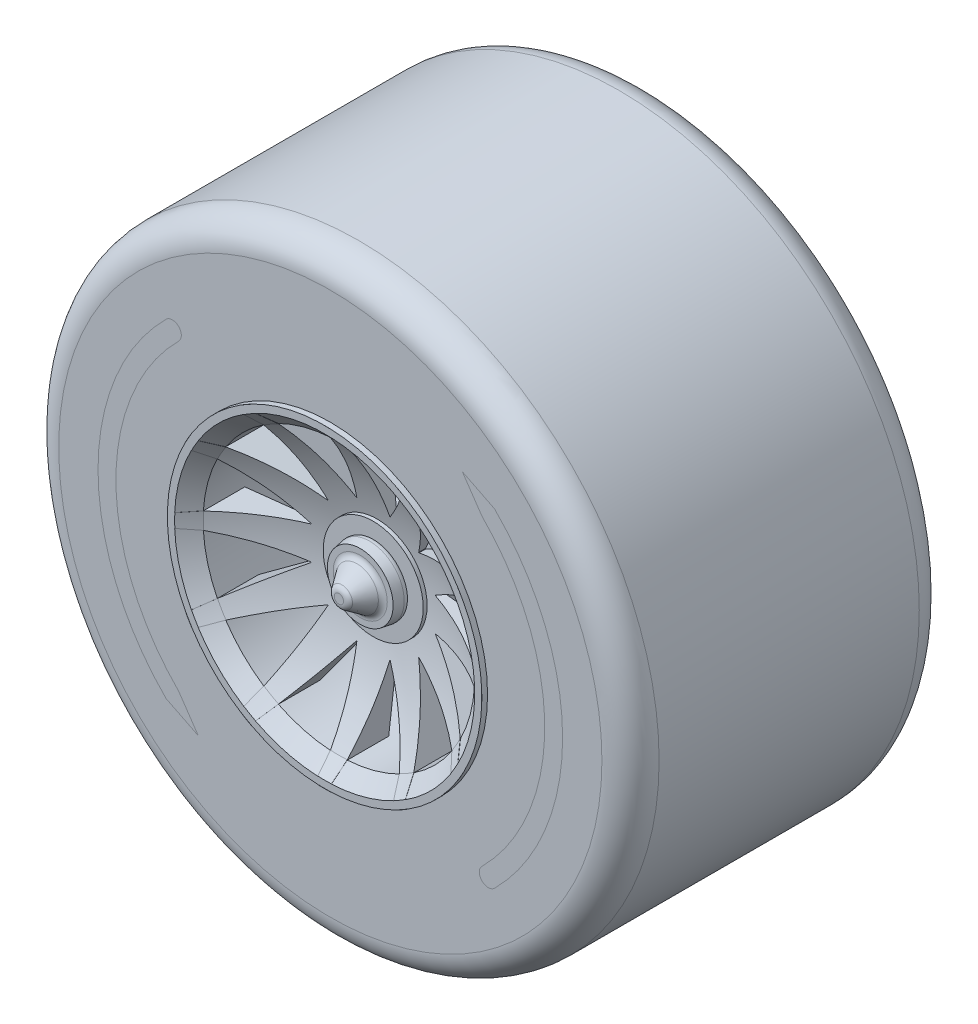
from build123d import *

# Parameters (mm, degrees)
SKETCH2_R                = 9.5
CUT_EXTRUDE1_DEPTH       = 24
CHAMFER1_SIZE            = 1
BOSS_EXTRUDE1_DEPTH      = 10
BOSS_EXTRUDE1_DEPTH_BACK = 3.5
FILLET1_R                = 0.5
BOSS_EXTRUDE2_START      = -3
SKETCH6_R                = 3.5
BOSS_EXTRUDE2_DEPTH      = 15
SKETCH7_R                = 2.55
CUT_EXTRUDE2_DEPTH       = 5


with BuildPart() as part:
    # Sketch1 → Revolve1 (revolve)
    with BuildSketch(Plane(origin=(0, 0, 0), x_dir=(0, 0, -1), z_dir=(1, 0, 0))):
        with BuildLine():
            Line((0, 0), (0, 21))
            Line((0, 21), (-9.1, 21))
            ThreePointArc((-9.1, 21), (-10.514213562, 20.414213562), (-11.1, 19))
            Line((-11.1, 19), (-11.1, 11))
            Line((-11.1, 11), (-11.5, 11))
            Line((-11.5, 11), (-11.5, 0))
            Line((-11.5, 0), (0, 0))
        make_face()
    revolve(axis=Axis((0, 0, 11.5), (0, 0, -1)))

    # Sketch2 → Cut-Extrude1 (cut)
    with BuildSketch(Plane.XY):
        Circle(SKETCH2_R)
    extrude(amount=CUT_EXTRUDE1_DEPTH, mode=Mode.SUBTRACT)

    # Chamfer1
    chamfer1_edges = [part.edges().sort_by_distance(p)[0] for p in [
        (-9.5, 0, 11.5),
    ]]
    chamfer(chamfer1_edges, length=CHAMFER1_SIZE)

    # Sketch3 → Boss-Extrude1 (add, two sides: drawn at the far end of the back side and taken through both)
    with BuildSketch(Plane.XY.offset(11.1).offset(-BOSS_EXTRUDE1_DEPTH_BACK)):
        with BuildLine():
            Line((-0.420515232, 10.991959195), (-1.150748195, 4.350376833))
            ThreePointArc((-1.150748195, 4.350376833), (-1.164685703, 4.346666218), (-1.178611246, 4.342910951))
            Line((-1.178611246, 4.342910951), (-5.131802724, 9.729573516))
            ThreePointArc((-5.131802724, 9.729573516), (-5.5, 9.526279442), (-5.860156471, 9.309058284))
            Line((-5.860156471, 9.309058284), (-3.171765587, 3.192162756))
            ThreePointArc((-3.171765587, 3.192162756), (-3.181980515, 3.181980515), (-3.192162756, 3.171765587))
            Line((-3.192162756, 3.171765587), (-9.309058284, 5.860156471))
            ThreePointArc((-9.309058284, 5.860156471), (-9.526279442, 5.5), (-9.729573516, 5.131802724))
            Line((-9.729573516, 5.131802724), (-4.342910951, 1.178611246))
            ThreePointArc((-4.342910951, 1.178611246), (-4.346666218, 1.164685703), (-4.350376833, 1.150748195))
            Line((-4.350376833, 1.150748195), (-10.991959195, 0.420515232))
            ThreePointArc((-10.991959195, 0.420515232), (-11, 0), (-10.991959195, -0.420515232))
            Line((-10.991959195, -0.420515232), (-4.350376833, -1.150748195))
            ThreePointArc((-4.350376833, -1.150748195), (-4.346666218, -1.164685703), (-4.342910951, -1.178611246))
            Line((-4.342910951, -1.178611246), (-9.729573516, -5.131802724))
            ThreePointArc((-9.729573516, -5.131802724), (-9.526279442, -5.5), (-9.309058284, -5.860156471))
            Line((-9.309058284, -5.860156471), (-3.192162756, -3.171765587))
            ThreePointArc((-3.192162756, -3.171765587), (-3.181980515, -3.181980515), (-3.171765587, -3.192162756))
            Line((-3.171765587, -3.192162756), (-5.860156471, -9.309058284))
            ThreePointArc((-5.860156471, -9.309058284), (-5.5, -9.526279442), (-5.131802724, -9.729573516))
            Line((-5.131802724, -9.729573516), (-1.178611246, -4.342910951))
            ThreePointArc((-1.178611246, -4.342910951), (-1.164685703, -4.346666218), (-1.150748195, -4.350376833))
            Line((-1.150748195, -4.350376833), (-0.420515232, -10.991959195))
            ThreePointArc((-0.420515232, -10.991959195), (0, -11), (0.420515232, -10.991959195))
            Line((0.420515232, -10.991959195), (1.150748195, -4.350376833))
            ThreePointArc((1.150748195, -4.350376833), (1.164685703, -4.346666218), (1.178611246, -4.342910951))
            Line((1.178611246, -4.342910951), (5.131802724, -9.729573516))
            ThreePointArc((5.131802724, -9.729573516), (5.5, -9.526279442), (5.860156471, -9.309058284))
            Line((5.860156471, -9.309058284), (3.171765587, -3.192162756))
            ThreePointArc((3.171765587, -3.192162756), (3.181980515, -3.181980515), (3.192162756, -3.171765587))
            Line((3.192162756, -3.171765587), (9.309058284, -5.860156471))
            ThreePointArc((9.309058284, -5.860156471), (9.526279442, -5.5), (9.729573516, -5.131802724))
            Line((9.729573516, -5.131802724), (4.342910951, -1.178611246))
            ThreePointArc((4.342910951, -1.178611246), (4.346666218, -1.164685703), (4.350376833, -1.150748195))
            Line((4.350376833, -1.150748195), (10.991959195, -0.420515232))
            ThreePointArc((10.991959195, -0.420515232), (11, 0), (10.991959195, 0.420515232))
            Line((10.991959195, 0.420515232), (4.350376833, 1.150748195))
            ThreePointArc((4.350376833, 1.150748195), (4.346666218, 1.164685703), (4.342910951, 1.178611246))
            Line((4.342910951, 1.178611246), (9.729573516, 5.131802724))
            ThreePointArc((9.729573516, 5.131802724), (9.526279442, 5.5), (9.309058284, 5.860156471))
            Line((9.309058284, 5.860156471), (3.192162756, 3.171765587))
            ThreePointArc((3.192162756, 3.171765587), (3.181980515, 3.181980515), (3.171765587, 3.192162756))
            Line((3.171765587, 3.192162756), (5.860156471, 9.309058284))
            ThreePointArc((5.860156471, 9.309058284), (5.5, 9.526279442), (5.131802724, 9.729573516))
            Line((5.131802724, 9.729573516), (1.178611246, 4.342910951))
            ThreePointArc((1.178611246, 4.342910951), (1.164685703, 4.346666218), (1.150748195, 4.350376833))
            Line((1.150748195, 4.350376833), (0.420515232, 10.991959195))
            ThreePointArc((0.420515232, 10.991959195), (0, 11), (-0.420515232, 10.991959195))
        make_face()
    extrude(amount=BOSS_EXTRUDE1_DEPTH + BOSS_EXTRUDE1_DEPTH_BACK)

    # Sketch4 → Cut-Revolve1 (revolve, cut)
    with BuildSketch(Plane(origin=(0, 0, 0), x_dir=(0, 0, -1), z_dir=(1, 0, 0))):
        with BuildLine():
            Line((-7.349907164, 0), (-21.650123175, 0))
            Line((-21.650123175, 0), (-21.650123175, 11.607676474))
            Line((-21.650123175, 11.607676474), (-11.849238103, 11.607676474))
            Line((-11.849238103, 11.607676474), (-11.5, 10.991959195))
            Line((-11.5, 10.991959195), (-11.5, 10.489214586))
            Line((-11.5, 10.489214586), (-10.5, 9.481875487))
            add(Edge.make_bspline(
                [(-10.5, 9.481875487), (-7.621615848, 5.423350738), (-7.349907164, 0)],
                knots=[0, 0, 0, 1, 1, 1], degree=2))
        make_face()
    revolve(axis=Axis((0, 0, 7.349907164), (0, 0, 1)), mode=Mode.SUBTRACT)


with BuildPart() as body_2:
    # Sketch5 → Revolve2 (revolve)
    with BuildSketch(Plane(origin=(0, 0, 0), x_dir=(0, 0, -1), z_dir=(1, 0, 0))):
        Polygon((-7.866268361, 2.5), (-7.380317588, 0), (-10.5, 0), (-10.5, 0.586546885), (-9.006923518, 1.629418183), (-9.006923518, 2.300934191), align=None)
    revolve(axis=Axis((0, 0, 0), (0, 0, 1)))

    # Fillet1
    fillet1_edges = [body_2.edges().sort_by_distance(p)[0] for p in [
        (0, -2.5, 7.866268361),
        (0, -1.629418183, 9.006923518),
        (0, -0.586546885, 10.5),
    ]]
    fillet(fillet1_edges, radius=FILLET1_R)


with BuildPart() as body_3:
    # Mirror1: mirrored copy
    add(part.part.mirror(Plane.XY))


with BuildPart() as body_4:
    # Mirror1 2: mirrored copy
    add(body_2.part.mirror(Plane.XY))


with BuildPart() as part_1:
    add(part.part)

    add(body_2.part)  # Boss-Extrude2 merges body 2

    add(body_3.part)  # Boss-Extrude2 merges body 3
    # Sketch6 → Boss-Extrude2 (add)
    with BuildSketch(Plane.XY.offset(11.1).offset(BOSS_EXTRUDE2_START)):
        Circle(SKETCH6_R)
    extrude(amount=-BOSS_EXTRUDE2_DEPTH)


with BuildPart() as cut_extrude2_tool:
    # Sketch7 → Cut-Extrude2 (new body)
    with BuildSketch(Plane(origin=(0, 0, -11.1), x_dir=(-1, 0, 0), z_dir=(0, 0, -1))):
        Circle(SKETCH7_R)
    extrude(amount=-CUT_EXTRUDE2_DEPTH)


with BuildPart() as part_2:
    add(part_1.part)

    # Cut-Extrude2: cut by cut_extrude2_tool
    add(cut_extrude2_tool.part, mode=Mode.SUBTRACT)


with BuildPart() as body_4_1:
    add(body_4.part)

    # Cut-Extrude2: cut by cut_extrude2_tool
    add(cut_extrude2_tool.part, mode=Mode.SUBTRACT)


solid = part_2.part
